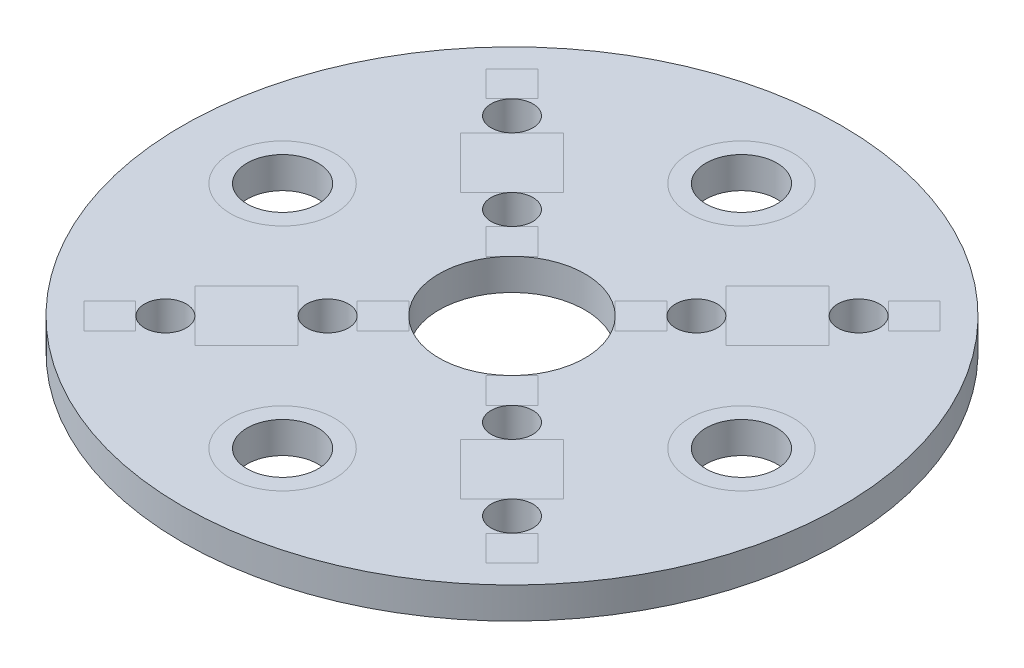
from build123d import *
from build123d.topology import SkipClean

# Parameters (mm, degrees)
SKETCH1_R           = 0.85
SKETCH1_R_2         = 1.75
SKETCH1_R_3         = 0.5
SKETCH1_R_4         = 0.25
BOSS_EXTRUDE1_DEPTH = 0.75
BOSS_EXTRUDE4_START = -0.75
SKETCH5_R           = 0.25
SKETCH5_R_2         = 0.289113168
BOSS_EXTRUDE4_DEPTH = 0.75
CUT_EXTRUDE1_START  = -0.75
CUT_EXTRUDE1_DEPTH  = 0.75


with BuildPart() as part:
    # Sketch1 → Boss-Extrude1 (new body)
    with BuildSketch(Plane(origin=(0, 0, 0), x_dir=(1, 0, 0), z_dir=(0, 1, 0))):
        with BuildLine():
            Line((-3.75, -6.953236656), (-3.75, -14.65))
            Line((-3.75, -14.65), (3.75, -14.65))
            Line((3.75, -14.65), (3.75, -6.953236656))
            ThreePointArc((3.75, -6.953236656), (0, 7.9), (-3.75, -6.953236656))
        make_face()
        with Locations((5.5, 0)):
            Circle(SKETCH1_R, mode=Mode.SUBTRACT)
        with Locations((0, -5.5)):
            Circle(SKETCH1_R, mode=Mode.SUBTRACT)
        with Locations((-5.5, 0)):
            Circle(SKETCH1_R, mode=Mode.SUBTRACT)
        with Locations((0, 5.5)):
            Circle(SKETCH1_R, mode=Mode.SUBTRACT)
        Circle(SKETCH1_R_2, mode=Mode.SUBTRACT)
        with Locations((-4.154, 4.154)):
            Circle(SKETCH1_R_3, mode=Mode.SUBTRACT)
        with Locations((-2.21, 2.21)):
            Circle(SKETCH1_R_3, mode=Mode.SUBTRACT)
        with Locations((4.154, 4.154)):
            Circle(SKETCH1_R_3, mode=Mode.SUBTRACT)
        with Locations((2.21, 2.21)):
            Circle(SKETCH1_R_3, mode=Mode.SUBTRACT)
        with Locations((4.154, -4.154)):
            Circle(SKETCH1_R_3, mode=Mode.SUBTRACT)
        with Locations((2.21, -2.21)):
            Circle(SKETCH1_R_3, mode=Mode.SUBTRACT)
        with Locations((-4.154, -4.154)):
            Circle(SKETCH1_R_3, mode=Mode.SUBTRACT)
        with Locations((-2.21, -2.21)):
            Circle(SKETCH1_R_3, mode=Mode.SUBTRACT)
        with Locations((-3, 0)):
            Circle(SKETCH1_R_4, mode=Mode.SUBTRACT)
        with Locations((-1.5, -10.75)):
            Circle(SKETCH1_R_4, mode=Mode.SUBTRACT)
        with Locations((3, 0)):
            Circle(SKETCH1_R_4, mode=Mode.SUBTRACT)
        with Locations((1.5, -10.75)):
            Circle(SKETCH1_R_4, mode=Mode.SUBTRACT)
        with Locations((-6.2, 2.25)):
            Circle(SKETCH1_R_4, mode=Mode.SUBTRACT)
        with Locations((0, -9.75)):
            Circle(SKETCH1_R_4, mode=Mode.SUBTRACT)
        with Locations((0, -7.75)):
            Circle(SKETCH1_R_4, mode=Mode.SUBTRACT)
        with Locations((-1, -8.75)):
            Circle(SKETCH1_R_4, mode=Mode.SUBTRACT)
        with Locations((1, -8.75)):
            Circle(SKETCH1_R_4, mode=Mode.SUBTRACT)
        with Locations((-5.9, 3.55)):
            Circle(SKETCH1_R_4, mode=Mode.SUBTRACT)
        with Locations((6.2, 2.25)):
            Circle(SKETCH1_R_4, mode=Mode.SUBTRACT)
        with Locations((5.9, 3.55)):
            Circle(SKETCH1_R_4, mode=Mode.SUBTRACT)
    extrude(amount=BOSS_EXTRUDE1_DEPTH)

    # Sketch5 → Boss-Extrude4 (add)
    with BuildSketch(Plane(origin=(0, 0.75, 0), x_dir=(1, 0, 0), z_dir=(0, 1, 0)).offset(BOSS_EXTRUDE4_START)):
        with Locations((-5.9, 3.55)):
            Circle(SKETCH5_R)
        with Locations((-6.2, 2.25)):
            Circle(SKETCH5_R)
        with Locations((5.9, 3.55)):
            Circle(SKETCH5_R)
        with Locations((6.2, 2.25)):
            Circle(SKETCH5_R)
        with Locations((3, 0)):
            Circle(SKETCH5_R)
        with Locations((-3, 0)):
            Circle(SKETCH5_R_2)
        with Locations((0, -7.75)):
            Circle(SKETCH5_R)
    extrude(amount=BOSS_EXTRUDE4_DEPTH)

    # Sketch6 → Cut-Extrude1 (cut)
    with SkipClean():  # the faces are left unmerged after this step: merging them gives an invalid solid
        with BuildSketch(Plane(origin=(0, 0.75, 0), x_dir=(1, 0, 0), z_dir=(0, 1, 0)).offset(CUT_EXTRUDE1_START)):
            with BuildLine():
                ThreePointArc((3.75, -6.953236656), (0, -7.9), (-3.75, -6.953236656))
                Line((-3.75, -6.953236656), (-3.75, -14.65))
                Line((-3.75, -14.65), (3.75, -14.65))
                Line((3.75, -14.65), (3.75, -6.953236656))
            make_face()
        extrude(amount=CUT_EXTRUDE1_DEPTH, mode=Mode.SUBTRACT)


solid = part.part
